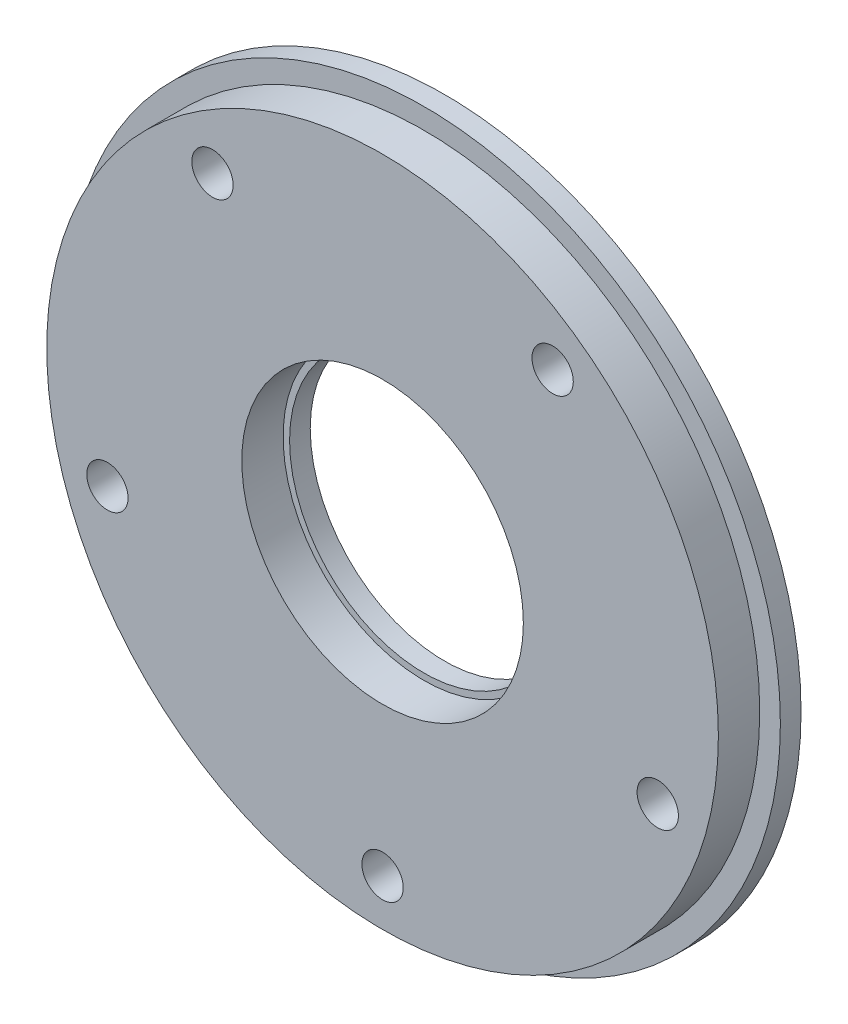
from build123d import *

# Parameters (mm, degrees)
SKETCH_1_R      = 34.5
SKETCH_1_R_2    = 13
SKETCH_1_R_3    = 2
EXTRUDE_1_DEPTH = 2
SKETCH_2_R      = 32.5
SKETCH_2_R_2    = 13.625
SKETCH_2_R_3    = 2
EXTRUDE_2_DEPTH = 4


with BuildPart() as part:
    # 草图1 → 凸台-拉伸1 (new body)
    with BuildSketch(Plane.XY):
        Circle(SKETCH_1_R)
        Circle(SKETCH_1_R_2, mode=Mode.SUBTRACT)
        with Locations((0, -28)):
            Circle(SKETCH_1_R_3, mode=Mode.SUBTRACT)
        with Locations((-26.629582456, -8.652475842)):
            Circle(SKETCH_1_R_3, mode=Mode.SUBTRACT)
        with Locations((-16.457987064, 22.652475842)):
            Circle(SKETCH_1_R_3, mode=Mode.SUBTRACT)
        with Locations((16.457987064, 22.652475842)):
            Circle(SKETCH_1_R_3, mode=Mode.SUBTRACT)
        with Locations((26.629582456, -8.652475842)):
            Circle(SKETCH_1_R_3, mode=Mode.SUBTRACT)
    extrude(amount=EXTRUDE_1_DEPTH)

    # 草图2 → 凸台-拉伸2 (add)
    with BuildSketch(Plane.XY.offset(2)):
        Circle(SKETCH_2_R)
        Circle(SKETCH_2_R_2, mode=Mode.SUBTRACT)
        with Locations((0, -28)):
            Circle(SKETCH_2_R_3, mode=Mode.SUBTRACT)
        with Locations((-26.629582456, -8.652475842)):
            Circle(SKETCH_2_R_3, mode=Mode.SUBTRACT)
        with Locations((-16.457987064, 22.652475842)):
            Circle(SKETCH_2_R_3, mode=Mode.SUBTRACT)
        with Locations((16.457987064, 22.652475842)):
            Circle(SKETCH_2_R_3, mode=Mode.SUBTRACT)
        with Locations((26.629582456, -8.652475842)):
            Circle(SKETCH_2_R_3, mode=Mode.SUBTRACT)
    extrude(amount=EXTRUDE_2_DEPTH)


solid = part.part
